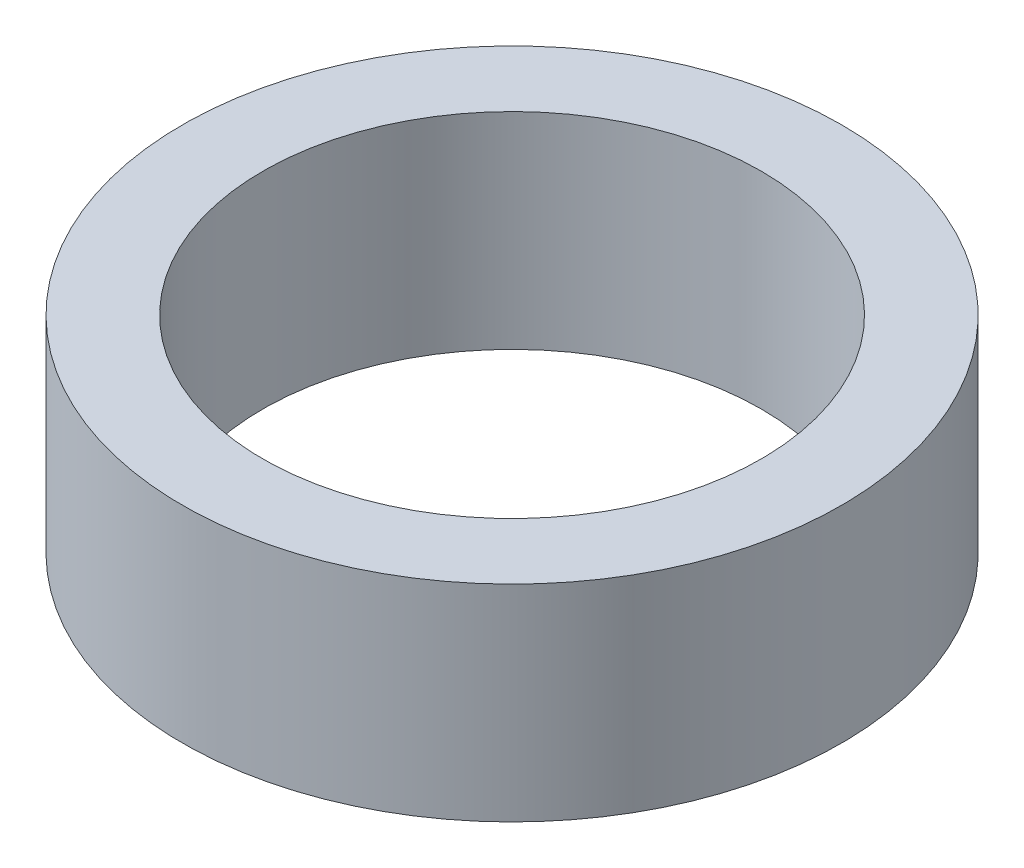
from build123d import *

# Parameters (mm, degrees)
SKETCH_1_W = 1.95
SKETCH_1_H = 5


with BuildPart() as part:
    # 草图1 → Rotary_seal_envelope (revolve)
    with BuildSketch(Plane.XY, mode=Mode.PRIVATE) as rotary_seal_envelope_sk:
        with Locations((7.025, 2.5)):
            Rectangle(SKETCH_1_W, SKETCH_1_H)
    revolve(rotary_seal_envelope_sk.sketch.rotate(Axis((0, 0, 0), (0, 1, 0)), 90), axis=Axis((0, 0, 0), (0, 1, 0)))


solid = part.part
